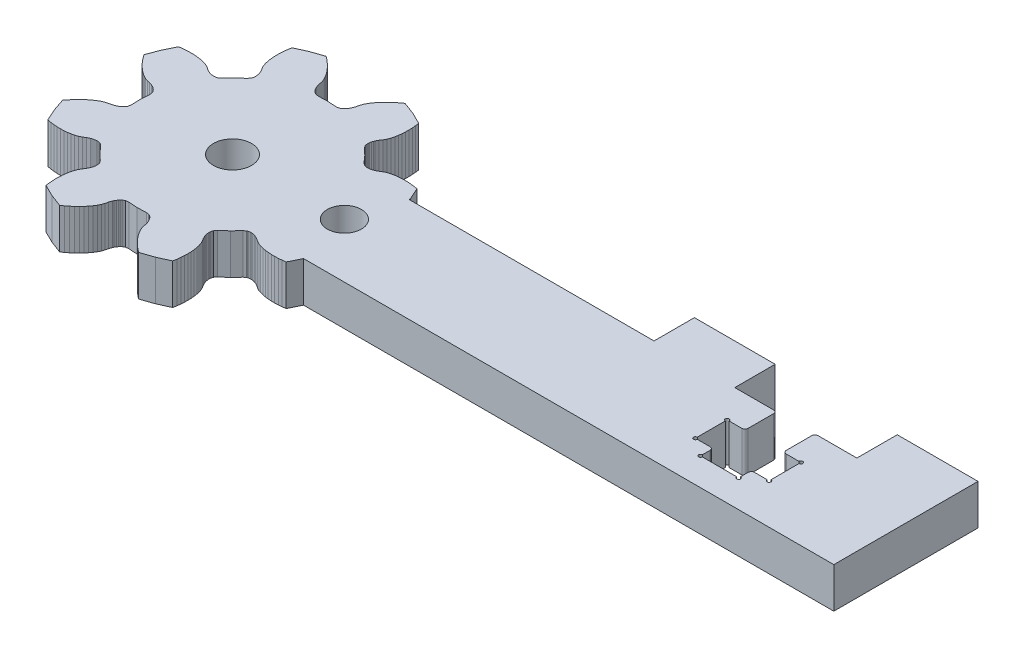
from build123d import *

# Parameters (mm, degrees)
SKETCH1_R           = 1.5
SKETCH1_R_2         = 1.3413
BOSS_EXTRUDE1_DEPTH = 3.175


with BuildPart() as part:
    # Sketch1 → Boss-Extrude1 (new body)
    with BuildSketch(Plane(origin=(0, 0, 0), x_dir=(1, 0, 0), z_dir=(0, 1, 0))):
        with BuildLine():
            Line((118.534060584, 166.096137226), (137.790699812, 166.096137226))
            Line((137.790699812, 166.096137226), (137.790699812, 169.271137226))
            Line((137.790699812, 169.271137226), (144.140699812, 169.271137226))
            Line((144.140699812, 169.271137226), (144.140699812, 166.096137226))
            Line((144.140699812, 166.096137226), (147.190699812, 166.096137226))
            ThreePointArc((147.190699812, 166.096137226), (147.367476508, 166.022913921), (147.440699812, 165.846137226))
            Line((147.440699812, 165.846137226), (147.440699812, 163.846137226))
            ThreePointArc((147.440699812, 163.846137226), (147.367476508, 163.66936053), (147.190699812, 163.596137226))
            Line((147.190699812, 163.596137226), (146.190699812, 163.596137226))
            ThreePointArc((146.190699812, 163.596137226), (145.934633795, 163.702203243), (146.040699812, 163.446137226))
            Line((146.040699812, 163.446137226), (146.040699812, 161.246137226))
            ThreePointArc((146.040699812, 161.246137226), (145.934633795, 160.990071208), (146.190699812, 161.096137226))
            Line((146.190699812, 161.096137226), (147.190699812, 161.096137226))
            ThreePointArc((147.190699812, 161.096137226), (147.367476508, 161.022913921), (147.440699812, 160.846137226))
            Line((147.440699812, 160.846137226), (147.440699812, 160.246137226))
            ThreePointArc((147.440699812, 160.246137226), (147.334633795, 159.990071208), (147.590699812, 160.096137226))
            Line((147.590699812, 160.096137226), (150.290699812, 160.096137226))
            ThreePointArc((150.290699812, 160.096137226), (150.54676583, 159.990071208), (150.440699812, 160.246137226))
            Line((150.440699812, 160.246137226), (150.440699812, 160.846137226))
            ThreePointArc((150.440699812, 160.846137226), (150.513923117, 161.022913921), (150.690699812, 161.096137226))
            Line((150.690699812, 161.096137226), (151.690699812, 161.096137226))
            ThreePointArc((151.690699812, 161.096137226), (151.94676583, 160.990071208), (151.840699812, 161.246137226))
            Line((151.840699812, 161.246137226), (151.840699812, 163.446137226))
            ThreePointArc((151.840699812, 163.446137226), (151.94676583, 163.702203243), (151.690699812, 163.596137226))
            Line((151.690699812, 163.596137226), (150.690699812, 163.596137226))
            ThreePointArc((150.690699812, 163.596137226), (150.513923117, 163.66936053), (150.440699812, 163.846137226))
            Line((150.440699812, 163.846137226), (150.440699812, 165.846137226))
            ThreePointArc((150.440699812, 165.846137226), (150.513923117, 166.022913921), (150.690699812, 166.096137226))
            Line((150.690699812, 166.096137226), (153.740699812, 166.096137226))
            Line((153.740699812, 166.096137226), (153.740699812, 169.271137226))
            Line((153.740699812, 169.271137226), (160.090699812, 169.271137226))
            Line((160.090699812, 169.271137226), (160.090699812, 166.096137226))
            Line((160.090699812, 166.096137226), (160.090699812, 157.932387226))
            Line((160.090699812, 157.932387226), (118.404460584, 157.925837226))
            Line((118.404460584, 157.925837226), (118.404460584, 157.938937226))
            Line((118.404460584, 157.938937226), (117.948960584, 157.011237226))
            Line((117.948960584, 157.011237226), (117.666260584, 156.973637226))
            Line((117.666260584, 156.973637226), (117.388060584, 156.949237226))
            Line((117.388060584, 156.949237226), (117.115260584, 156.938437226))
            Line((117.115260584, 156.938437226), (116.848260584, 156.941137226))
            Line((116.848260584, 156.941137226), (116.587860584, 156.957637226))
            Line((116.587860584, 156.957637226), (116.334960584, 156.988337226))
            Line((116.334960584, 156.988337226), (116.090460584, 157.033737226))
            Line((116.090460584, 157.033737226), (115.855760584, 157.095237226))
            Line((115.855760584, 157.095237226), (115.633260584, 157.175137226))
            Line((115.633260584, 157.175137226), (115.430660584, 157.283537226))
            Line((115.430660584, 157.283537226), (115.242560584, 157.412637226))
            Line((115.242560584, 157.412637226), (115.039160584, 157.520037226))
            Line((115.039160584, 157.520037226), (114.930060584, 157.563737226))
            Line((114.930060584, 157.563737226), (114.814560584, 157.598937226))
            Line((114.814560584, 157.598937226), (114.690760584, 157.623237226))
            Line((114.690760584, 157.623237226), (114.624660584, 157.630037226))
            Line((114.624660584, 157.630037226), (114.554760584, 157.631937226))
            Line((114.554760584, 157.631937226), (114.479660584, 157.627537226))
            Line((114.479660584, 157.627537226), (114.396560584, 157.613337226))
            Line((114.396560584, 157.613337226), (114.298660584, 157.581537226))
            Line((114.298660584, 157.581537226), (114.114360584, 157.447837226))
            Line((114.114360584, 157.447837226), (113.631560584, 156.933037226))
            Line((113.631560584, 156.933037226), (113.101860584, 156.466737226))
            Line((113.101860584, 156.466737226), (112.962460584, 156.286637226))
            Line((112.962460584, 156.286637226), (112.927560584, 156.189837226))
            Line((112.927560584, 156.189837226), (112.910860584, 156.107237226))
            Line((112.910860584, 156.107237226), (112.904060584, 156.032237226))
            Line((112.904060584, 156.032237226), (112.903760584, 155.962337226))
            Line((112.903760584, 155.962337226), (112.908460584, 155.896037226))
            Line((112.908460584, 155.896037226), (112.928860584, 155.771537226))
            Line((112.928860584, 155.771537226), (112.960360584, 155.655037226))
            Line((112.960360584, 155.655037226), (113.000660584, 155.544637226))
            Line((113.000660584, 155.544637226), (113.101660584, 155.337837226))
            Line((113.101660584, 155.337837226), (113.224760584, 155.145937226))
            Line((113.224760584, 155.145937226), (113.326760584, 154.939937226))
            Line((113.326760584, 154.939937226), (113.399560584, 154.715037226))
            Line((113.399560584, 154.715037226), (113.453660584, 154.478537226))
            Line((113.453660584, 154.478537226), (113.491460584, 154.232737226))
            Line((113.491460584, 154.232737226), (113.514160584, 153.978937226))
            Line((113.514160584, 153.978937226), (113.522460584, 153.718237226))
            Line((113.522460584, 153.718237226), (113.516760584, 153.451337226))
            Line((113.516760584, 153.451337226), (113.497360584, 153.178937226))
            Line((113.497360584, 153.178937226), (113.464360584, 152.901637226))
            Line((113.464360584, 152.901637226), (113.417760584, 152.620237226))
            Line((113.417760584, 152.620237226), (112.476260584, 152.194137226))
            Line((112.476260584, 152.194137226), (111.498260584, 151.860237226))
            Line((111.498260584, 151.860237226), (111.271660584, 152.033537226))
            Line((111.271660584, 152.033537226), (111.057760584, 152.213037226))
            Line((111.057760584, 152.213037226), (110.857160584, 152.398237226))
            Line((110.857160584, 152.398237226), (110.670260584, 152.588937226))
            Line((110.670260584, 152.588937226), (110.497860584, 152.784737226))
            Line((110.497860584, 152.784737226), (110.340660584, 152.985237226))
            Line((110.340660584, 152.985237226), (110.199960584, 153.190337226))
            Line((110.199960584, 153.190337226), (110.077460584, 153.399737226))
            Line((110.077460584, 153.399737226), (109.976660584, 153.613537226))
            Line((109.976660584, 153.613537226), (109.909960584, 153.833537226))
            Line((109.909960584, 153.833537226), (109.868360584, 154.057737226))
            Line((109.868360584, 154.057737226), (109.800360584, 154.277537226))
            Line((109.800360584, 154.277537226), (109.754160584, 154.385637226))
            Line((109.754160584, 154.385637226), (109.697360584, 154.492137226))
            Line((109.697360584, 154.492137226), (109.627060584, 154.596837226))
            Line((109.627060584, 154.596837226), (109.585060584, 154.648337226))
            Line((109.585060584, 154.648337226), (109.537060584, 154.699137226))
            Line((109.537060584, 154.699137226), (109.480760584, 154.749137226))
            Line((109.480760584, 154.749137226), (109.412060584, 154.797937226))
            Line((109.412060584, 154.797937226), (109.320260584, 154.844637226))
            Line((109.320260584, 154.844637226), (109.095460584, 154.880437226))
            Line((109.095460584, 154.880437226), (108.390060584, 154.857737226))
            Line((108.390060584, 154.857737226), (107.685660584, 154.902637226))
            Line((107.685660584, 154.902637226), (107.459860584, 154.873837226))
            Line((107.459860584, 154.873837226), (107.366660584, 154.830037226))
            Line((107.366660584, 154.830037226), (107.296460584, 154.783437226))
            Line((107.296460584, 154.783437226), (107.238560584, 154.735237226))
            Line((107.238560584, 154.735237226), (107.188960584, 154.685937226))
            Line((107.188960584, 154.685937226), (107.145460584, 154.635837226))
            Line((107.145460584, 154.635837226), (107.071860584, 154.533337226))
            Line((107.071860584, 154.533337226), (107.011760584, 154.428637226))
            Line((107.011760584, 154.428637226), (106.962160584, 154.322137226))
            Line((106.962160584, 154.322137226), (106.887360584, 154.104537226))
            Line((106.887360584, 154.104537226), (106.838660584, 153.881737226))
            Line((106.838660584, 153.881737226), (106.765160584, 153.663937226))
            Line((106.765160584, 153.663937226), (106.657560584, 153.453437226))
            Line((106.657560584, 153.453437226), (106.528660584, 153.248037226))
            Line((106.528660584, 153.248037226), (106.381560584, 153.047437226))
            Line((106.381560584, 153.047437226), (106.218160584, 152.851937226))
            Line((106.218160584, 152.851937226), (106.039660584, 152.661737226))
            Line((106.039660584, 152.661737226), (105.846860584, 152.476937226))
            Line((105.846860584, 152.476937226), (105.640560584, 152.298037226))
            Line((105.640560584, 152.298037226), (105.421160584, 152.125437226))
            Line((105.421160584, 152.125437226), (105.189160584, 151.959337226))
            Line((105.189160584, 151.959337226), (104.222160584, 152.323837226))
            Line((104.222160584, 152.323837226), (103.294460584, 152.779237226))
            Line((103.294460584, 152.779237226), (103.256760584, 153.062037226))
            Line((103.256760584, 153.062037226), (103.232460584, 153.340137226))
            Line((103.232460584, 153.340137226), (103.221660584, 153.613037226))
            Line((103.221660584, 153.613037226), (103.224360584, 153.879937226))
            Line((103.224360584, 153.879937226), (103.240860584, 154.140337226))
            Line((103.240860584, 154.140337226), (103.271460584, 154.393337226))
            Line((103.271460584, 154.393337226), (103.316960584, 154.637837226))
            Line((103.316960584, 154.637837226), (103.378460584, 154.872437226))
            Line((103.378460584, 154.872437226), (103.458360584, 155.094937226))
            Line((103.458360584, 155.094937226), (103.566760584, 155.297637226))
            Line((103.566760584, 155.297637226), (103.695860584, 155.485637226))
            Line((103.695860584, 155.485637226), (103.803260584, 155.689137226))
            Line((103.803260584, 155.689137226), (103.846960584, 155.798237226))
            Line((103.846960584, 155.798237226), (103.882160584, 155.913637226))
            Line((103.882160584, 155.913637226), (103.906460584, 156.037437226))
            Line((103.906460584, 156.037437226), (103.913160584, 156.103537226))
            Line((103.913160584, 156.103537226), (103.915160584, 156.173437226))
            Line((103.915160584, 156.173437226), (103.910660584, 156.248637226))
            Line((103.910660584, 156.248637226), (103.896560584, 156.331737226))
            Line((103.896560584, 156.331737226), (103.864760584, 156.429637226))
            Line((103.864760584, 156.429637226), (103.731060584, 156.613937226))
            Line((103.731060584, 156.613937226), (103.216260584, 157.096637226))
            Line((103.216260584, 157.096637226), (102.749860584, 157.626437226))
            Line((102.749860584, 157.626437226), (102.569860584, 157.765737226))
            Line((102.569860584, 157.765737226), (102.473060584, 157.800737226))
            Line((102.473060584, 157.800737226), (102.390460584, 157.817437226))
            Line((102.390460584, 157.817437226), (102.315460584, 157.824237226))
            Line((102.315460584, 157.824237226), (102.245460584, 157.824437226))
            Line((102.245460584, 157.824437226), (102.179260584, 157.819737226))
            Line((102.179260584, 157.819737226), (102.054760584, 157.799437226))
            Line((102.054760584, 157.799437226), (101.938260584, 157.767837226))
            Line((101.938260584, 157.767837226), (101.827860584, 157.727637226))
            Line((101.827860584, 157.727637226), (101.621060584, 157.626637226))
            Line((101.621060584, 157.626637226), (101.429160584, 157.503537226))
            Line((101.429160584, 157.503537226), (101.223160584, 157.401537226))
            Line((101.223160584, 157.401537226), (100.998260584, 157.328637226))
            Line((100.998260584, 157.328637226), (100.761760584, 157.274537226))
            Line((100.761760584, 157.274537226), (100.515960584, 157.236837226))
            Line((100.515960584, 157.236837226), (100.262160584, 157.214137226))
            Line((100.262160584, 157.214137226), (100.001460584, 157.205837226))
            Line((100.001460584, 157.205837226), (99.734460584, 157.211437226))
            Line((99.734460584, 157.211437226), (99.462060584, 157.230837226))
            Line((99.462060584, 157.230837226), (99.184860584, 157.263937226))
            Line((99.184860584, 157.263937226), (98.903360584, 157.310437226))
            Line((98.903360584, 157.310437226), (98.477360584, 158.252037226))
            Line((98.477360584, 158.252037226), (98.143460584, 159.230037226))
            Line((98.143460584, 159.230037226), (98.316660584, 159.456637226))
            Line((98.316660584, 159.456637226), (98.496160584, 159.670437226))
            Line((98.496160584, 159.670437226), (98.681460584, 159.871137226))
            Line((98.681460584, 159.871137226), (98.872160584, 160.057937226))
            Line((98.872160584, 160.057937226), (99.067960584, 160.230437226))
            Line((99.067960584, 160.230437226), (99.268460584, 160.387637226))
            Line((99.268460584, 160.387637226), (99.473560584, 160.528337226))
            Line((99.473560584, 160.528337226), (99.682860584, 160.650737226))
            Line((99.682860584, 160.650737226), (99.896760584, 160.751637226))
            Line((99.896760584, 160.751637226), (100.116660584, 160.818337226))
            Line((100.116660584, 160.818337226), (100.340960584, 160.859937226))
            Line((100.340960584, 160.859937226), (100.560760584, 160.927837226))
            Line((100.560760584, 160.927837226), (100.668860584, 160.974137226))
            Line((100.668860584, 160.974137226), (100.775260584, 161.030837226))
            Line((100.775260584, 161.030837226), (100.879960584, 161.101237226))
            Line((100.879960584, 161.101237226), (100.931560584, 161.143137226))
            Line((100.931560584, 161.143137226), (100.982360584, 161.191237226))
            Line((100.982360584, 161.191237226), (101.032360584, 161.247537226))
            Line((101.032360584, 161.247537226), (101.081160584, 161.316237226))
            Line((101.081160584, 161.316237226), (101.127860584, 161.408037226))
            Line((101.127860584, 161.408037226), (101.163660584, 161.632837226))
            Line((101.163660584, 161.632837226), (101.140860584, 162.338237226))
            Line((101.140860584, 162.338237226), (101.185760584, 163.042537226))
            Line((101.185760584, 163.042537226), (101.157060584, 163.268337226))
            Line((101.157060584, 163.268337226), (101.113260584, 163.361537226))
            Line((101.113260584, 163.361537226), (101.066660584, 163.431837226))
            Line((101.066660584, 163.431837226), (101.018460584, 163.489637226))
            Line((101.018460584, 163.489637226), (100.969160584, 163.539237226))
            Line((100.969160584, 163.539237226), (100.918960584, 163.582837226))
            Line((100.918960584, 163.582837226), (100.816560584, 163.656437226))
            Line((100.816560584, 163.656437226), (100.711860584, 163.716537226))
            Line((100.711860584, 163.716537226), (100.605360584, 163.766137226))
            Line((100.605360584, 163.766137226), (100.387760584, 163.840937226))
            Line((100.387760584, 163.840937226), (100.164960584, 163.889537226))
            Line((100.164960584, 163.889537226), (99.947160584, 163.963137226))
            Line((99.947160584, 163.963137226), (99.736660584, 164.070637226))
            Line((99.736660584, 164.070637226), (99.531160584, 164.199637226))
            Line((99.531160584, 164.199637226), (99.330660584, 164.346737226))
            Line((99.330660584, 164.346737226), (99.135160584, 164.510137226))
            Line((99.135160584, 164.510137226), (98.944860584, 164.688637226))
            Line((98.944860584, 164.688637226), (98.760160584, 164.881337226))
            Line((98.760160584, 164.881337226), (98.581260584, 165.087737226))
            Line((98.581260584, 165.087737226), (98.408660584, 165.307137226))
            Line((98.408660584, 165.307137226), (98.242560584, 165.539037226))
            Line((98.242560584, 165.539037226), (98.607060584, 166.506037226))
            Line((98.607060584, 166.506037226), (99.062460584, 167.433737226))
            Line((99.062460584, 167.433737226), (99.345260584, 167.471437226))
            Line((99.345260584, 167.471437226), (99.623360584, 167.495737226))
            Line((99.623360584, 167.495737226), (99.896260584, 167.506637226))
            Line((99.896260584, 167.506637226), (100.163160584, 167.503937226))
            Line((100.163160584, 167.503937226), (100.423560584, 167.487437226))
            Line((100.423560584, 167.487437226), (100.676460584, 167.456737226))
            Line((100.676460584, 167.456737226), (100.920960584, 167.411237226))
            Line((100.920960584, 167.411237226), (101.155660584, 167.349837226))
            Line((101.155660584, 167.349837226), (101.378160584, 167.269937226))
            Line((101.378160584, 167.269937226), (101.580860584, 167.161537226))
            Line((101.580860584, 167.161537226), (101.768860584, 167.032437226))
            Line((101.768860584, 167.032437226), (101.972360584, 166.924937226))
            Line((101.972360584, 166.924937226), (102.081460584, 166.881337226))
            Line((102.081460584, 166.881337226), (102.196860584, 166.846137226))
            Line((102.196860584, 166.846137226), (102.320660584, 166.821837226))
            Line((102.320660584, 166.821837226), (102.386760584, 166.815037226))
            Line((102.386760584, 166.815037226), (102.456660584, 166.813137226))
            Line((102.456660584, 166.813137226), (102.531760584, 166.817537226))
            Line((102.531760584, 166.817537226), (102.614860584, 166.831637226))
            Line((102.614860584, 166.831637226), (102.712860584, 166.863537226))
            Line((102.712860584, 166.863537226), (102.897160584, 166.997137226))
            Line((102.897160584, 166.997137226), (103.379860584, 167.512037226))
            Line((103.379860584, 167.512037226), (103.909560584, 167.978337226))
            Line((103.909560584, 167.978337226), (104.048960584, 168.158337226))
            Line((104.048960584, 168.158337226), (104.083860584, 168.255237226))
            Line((104.083860584, 168.255237226), (104.100560584, 168.337837226))
            Line((104.100560584, 168.337837226), (104.107460584, 168.412737226))
            Line((104.107460584, 168.412737226), (104.107660584, 168.482737226))
            Line((104.107660584, 168.482737226), (104.102960584, 168.549037226))
            Line((104.102960584, 168.549037226), (104.082560584, 168.673537226))
            Line((104.082560584, 168.673537226), (104.051060584, 168.789937226))
            Line((104.051060584, 168.789937226), (104.010760584, 168.900337226))
            Line((104.010760584, 168.900337226), (103.909860584, 169.107137226))
            Line((103.909860584, 169.107137226), (103.786660584, 169.299137226))
            Line((103.786660584, 169.299137226), (103.684660584, 169.505137226))
            Line((103.684660584, 169.505137226), (103.611860584, 169.730037226))
            Line((103.611860584, 169.730037226), (103.557760584, 169.966537226))
            Line((103.557760584, 169.966537226), (103.519960584, 170.212237226))
            Line((103.519960584, 170.212237226), (103.497360584, 170.466137226))
            Line((103.497360584, 170.466137226), (103.488960584, 170.726837226))
            Line((103.488960584, 170.726837226), (103.494660584, 170.993737226))
            Line((103.494660584, 170.993737226), (103.514060584, 171.266137226))
            Line((103.514060584, 171.266137226), (103.547160584, 171.543337226))
            Line((103.547160584, 171.543337226), (103.593660584, 171.824837226))
            Line((103.593660584, 171.824837226), (104.535260584, 172.250837226))
            Line((104.535260584, 172.250837226), (105.513260584, 172.584837226))
            Line((105.513260584, 172.584837226), (105.739860584, 172.411537226))
            Line((105.739860584, 172.411537226), (105.953660584, 172.232037226))
            Line((105.953660584, 172.232037226), (106.154260584, 172.046737226))
            Line((106.154260584, 172.046737226), (106.341160584, 171.856037226))
            Line((106.341160584, 171.856037226), (106.513560584, 171.660337226))
            Line((106.513560584, 171.660337226), (106.670760584, 171.459737226))
            Line((106.670760584, 171.459737226), (106.811560584, 171.254737226))
            Line((106.811560584, 171.254737226), (106.933960584, 171.045337226))
            Line((106.933960584, 171.045337226), (107.034860584, 170.831537226))
            Line((107.034860584, 170.831537226), (107.101460584, 170.611537226))
            Line((107.101460584, 170.611537226), (107.143160584, 170.387337226))
            Line((107.143160584, 170.387337226), (107.211060584, 170.167437226))
            Line((107.211060584, 170.167437226), (107.257360584, 170.059437226))
            Line((107.257360584, 170.059437226), (107.314060584, 169.952937226))
            Line((107.314060584, 169.952937226), (107.384360584, 169.848237226))
            Line((107.384360584, 169.848237226), (107.426360584, 169.796737226))
            Line((107.426360584, 169.796737226), (107.474460584, 169.745937226))
            Line((107.474460584, 169.745937226), (107.530660584, 169.695937226))
            Line((107.530660584, 169.695937226), (107.599460584, 169.647137226))
            Line((107.599460584, 169.647137226), (107.691160584, 169.600437226))
            Line((107.691160584, 169.600437226), (107.916060584, 169.564637226))
            Line((107.916060584, 169.564637226), (108.621460584, 169.587337226))
            Line((108.621460584, 169.587337226), (109.325760584, 169.542437226))
            Line((109.325760584, 169.542437226), (109.551560584, 169.571237226))
            Line((109.551560584, 169.571237226), (109.644760584, 169.615037226))
            Line((109.644760584, 169.615037226), (109.714960584, 169.661537226))
            Line((109.714960584, 169.661537226), (109.772860584, 169.709737226))
            Line((109.772860584, 169.709737226), (109.822460584, 169.759037226))
            Line((109.822460584, 169.759037226), (109.866060584, 169.809237226))
            Line((109.866060584, 169.809237226), (109.939660584, 169.911637226))
            Line((109.939660584, 169.911637226), (109.999660584, 170.016337226))
            Line((109.999660584, 170.016337226), (110.049260584, 170.122837226))
            Line((110.049260584, 170.122837226), (110.124060584, 170.340537226))
            Line((110.124060584, 170.340537226), (110.172760584, 170.563337226))
            Line((110.172760584, 170.563337226), (110.246360584, 170.781037226))
            Line((110.246360584, 170.781037226), (110.353860584, 170.991637226))
            Line((110.353860584, 170.991637226), (110.482860584, 171.197037226))
            Line((110.482860584, 171.197037226), (110.629960584, 171.397537226))
            Line((110.629960584, 171.397537226), (110.793360584, 171.593037226))
            Line((110.793360584, 171.593037226), (110.971760584, 171.783337226))
            Line((110.971760584, 171.783337226), (111.164560584, 171.968137226))
            Line((111.164560584, 171.968137226), (111.370960584, 172.146937226))
            Line((111.370960584, 172.146937226), (111.590260584, 172.319637226))
            Line((111.590260584, 172.319637226), (111.822260584, 172.485737226))
            Line((111.822260584, 172.485737226), (112.789260584, 172.121237226))
            Line((112.789260584, 172.121237226), (113.716960584, 171.665837226))
            Line((113.716960584, 171.665837226), (113.754660584, 171.383037226))
            Line((113.754660584, 171.383037226), (113.778960584, 171.104937226))
            Line((113.778960584, 171.104937226), (113.789860584, 170.832037226))
            Line((113.789860584, 170.832037226), (113.787060584, 170.565037226))
            Line((113.787060584, 170.565037226), (113.770560584, 170.304737226))
            Line((113.770560584, 170.304737226), (113.739960584, 170.051737226))
            Line((113.739960584, 170.051737226), (113.694460584, 169.807237226))
            Line((113.694460584, 169.807237226), (113.632960584, 169.572637226))
            Line((113.632960584, 169.572637226), (113.553160584, 169.350037226))
            Line((113.553160584, 169.350037226), (113.444660584, 169.147437226))
            Line((113.444660584, 169.147437226), (113.315660584, 168.959437226))
            Line((113.315660584, 168.959437226), (113.208160584, 168.755937226))
            Line((113.208160584, 168.755937226), (113.164460584, 168.646837226))
            Line((113.164460584, 168.646837226), (113.129260584, 168.531337226))
            Line((113.129260584, 168.531337226), (113.105060584, 168.407637226))
            Line((113.105060584, 168.407637226), (113.098260584, 168.341537226))
            Line((113.098260584, 168.341537226), (113.096260584, 168.271637226))
            Line((113.096260584, 168.271637226), (113.100760584, 168.196437226))
            Line((113.100760584, 168.196437226), (113.114860584, 168.113337226))
            Line((113.114860584, 168.113337226), (113.146760584, 168.015437226))
            Line((113.146760584, 168.015437226), (113.280360584, 167.831137226))
            Line((113.280360584, 167.831137226), (113.795260584, 167.348437226))
            Line((113.795260584, 167.348437226), (114.261560584, 166.818637226))
            Line((114.261560584, 166.818637226), (114.441560584, 166.679237226))
            Line((114.441560584, 166.679237226), (114.538460584, 166.644337226))
            Line((114.538460584, 166.644337226), (114.621060584, 166.627637226))
            Line((114.621060584, 166.627637226), (114.695960584, 166.620837226))
            Line((114.695960584, 166.620837226), (114.765960584, 166.620637226))
            Line((114.765960584, 166.620637226), (114.832260584, 166.625337226))
            Line((114.832260584, 166.625337226), (114.956660584, 166.645637226))
            Line((114.956660584, 166.645637226), (115.073160584, 166.677237226))
            Line((115.073160584, 166.677237226), (115.183560584, 166.717437226))
            Line((115.183560584, 166.717437226), (115.390360584, 166.818437226))
            Line((115.390360584, 166.818437226), (115.582360584, 166.941537226))
            Line((115.582360584, 166.941537226), (115.788260584, 167.043537226))
            Line((115.788260584, 167.043537226), (116.013260584, 167.116437226))
            Line((116.013260584, 167.116437226), (116.249660584, 167.170437226))
            Line((116.249660584, 167.170437226), (116.495560584, 167.208237226))
            Line((116.495560584, 167.208237226), (116.749260584, 167.230937226))
            Line((116.749260584, 167.230937226), (117.010060584, 167.239237226))
            Line((117.010060584, 167.239237226), (117.276960584, 167.233637226))
            Line((117.276960584, 167.233637226), (117.549360584, 167.214137226))
            Line((117.549360584, 167.214137226), (117.826560584, 167.181137226))
            Line((117.826560584, 167.181137226), (118.108060584, 167.134537226))
            Line((118.108060584, 167.134537226), (118.534060584, 166.193037226))
            Line((118.534060584, 166.193037226), (118.534060584, 166.096137226))
        make_face()
        with Locations(Location((108.516060584, 162.222537226, 0), (0, 0, 270))):
            Circle(SKETCH1_R, mode=Mode.SUBTRACT)
        with Locations(Location((117.331860584, 162.206037226, 0), (0, 0, 270))):
            Circle(SKETCH1_R_2, mode=Mode.SUBTRACT)
    extrude(amount=BOSS_EXTRUDE1_DEPTH)


solid = part.part
